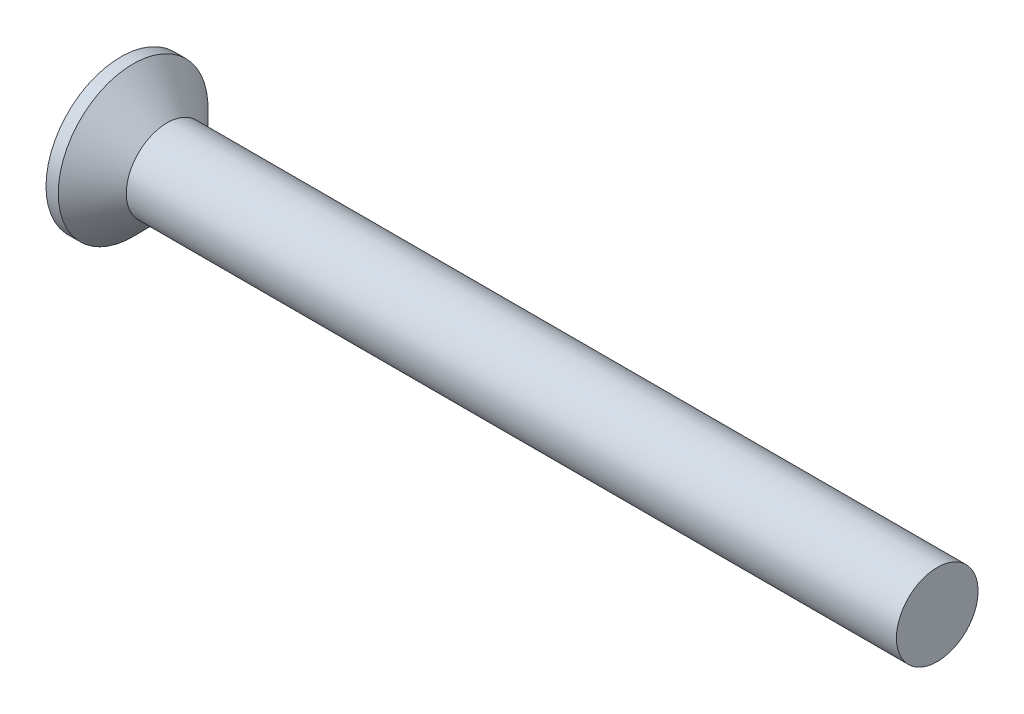
from build123d import *

# Parameters (mm, degrees)
CIRPATTERN1_COUNT = 2
CIRPATTERN1_ANGLE = 90


with BuildPart() as part:
    # BodySke → Base-Revolve (revolve)
    with BuildSketch(Plane.XY, mode=Mode.PRIVATE) as base_revolve_sk:
        Polygon((0, 0), (0, 2.75), (0.45, 2.75), (1.7, 1.5), (30, 1.5), (30, 0), align=None)
    revolve(base_revolve_sk.sketch.rotate(Axis((-6.35, 0, 0), (1, 0, 0)), 90), axis=Axis((-6.35, 0, 0), (1, 0, 0)))

    # Sketch3 → Cross section 0
    with BuildSketch(Plane.ZY):
        with BuildLine():
            Line((-0.395, 1.55), (0.395, 1.55))
            Line((0.395, 1.55), (0.395, -1.55))
            Line((0.395, -1.55), (-0.395, -1.55))
            Line((-0.395, -1.55), (-0.395, 1.55))
        make_face()
    # Sketch4 → Cross section 1
    with BuildSketch(Plane.ZY.offset(-2.08)):
        with BuildLine():
            Line((-0.1975, 0.1975), (0.1975, 0.1975))
            Line((0.1975, 0.1975), (0.1975, -0.1975))
            Line((0.1975, -0.1975), (-0.1975, -0.1975))
            Line((-0.1975, -0.1975), (-0.1975, 0.1975))
        make_face()
    cross = loft(mode=Mode.SUBTRACT)

    # CirPattern1: Cross ×2 about axis
    cirpattern1_axis = Axis((0, 0, 0), (1, 0, 0))
    for i in range(1, CIRPATTERN1_COUNT):
        add(cross.rotate(cirpattern1_axis, i * CIRPATTERN1_ANGLE / (CIRPATTERN1_COUNT - 1)), mode=Mode.SUBTRACT)


solid = part.part
